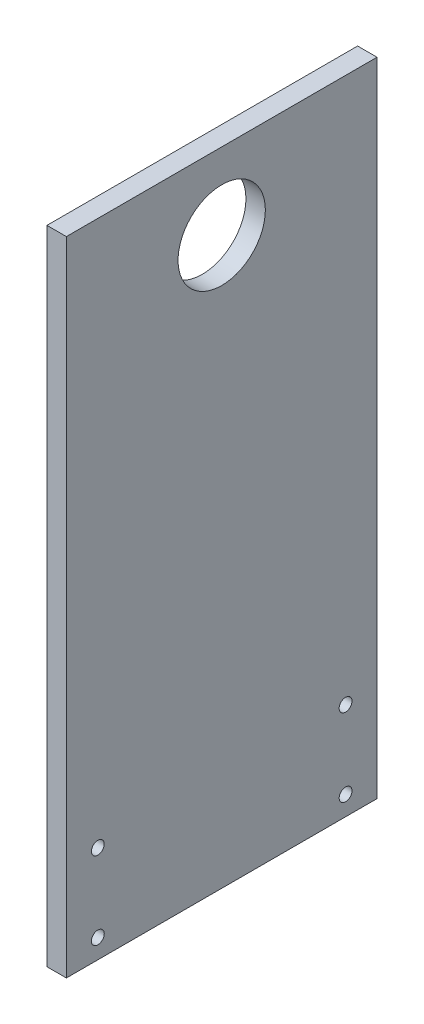
from build123d import *

# Parameters (mm, degrees)
SKETCH1_W           = 101.6
SKETCH1_H           = 210
SKETCH1_R           = 2.1
SKETCH1_R_2         = 14.275
BOSS_EXTRUDE1_DEPTH = 6.35


with BuildPart() as part:
    # Sketch1 → Boss-Extrude1 (new body)
    with BuildSketch(Plane(origin=(0, 0, 0), x_dir=(0, 0, -1), z_dir=(1, 0, 0))):
        Rectangle(SKETCH1_W, SKETCH1_H)
        with Locations((-40.513, -98.65)):
            Circle(SKETCH1_R, mode=Mode.SUBTRACT)
        with Locations((40.513, -98.65)):
            Circle(SKETCH1_R, mode=Mode.SUBTRACT)
        with Locations((0, 80)):
            Circle(SKETCH1_R_2, mode=Mode.SUBTRACT)
        with Locations((-40.513, -73.25)):
            Circle(SKETCH1_R, mode=Mode.SUBTRACT)
        with Locations((40.513, -73.25)):
            Circle(SKETCH1_R, mode=Mode.SUBTRACT)
    extrude(amount=BOSS_EXTRUDE1_DEPTH)


solid = part.part
